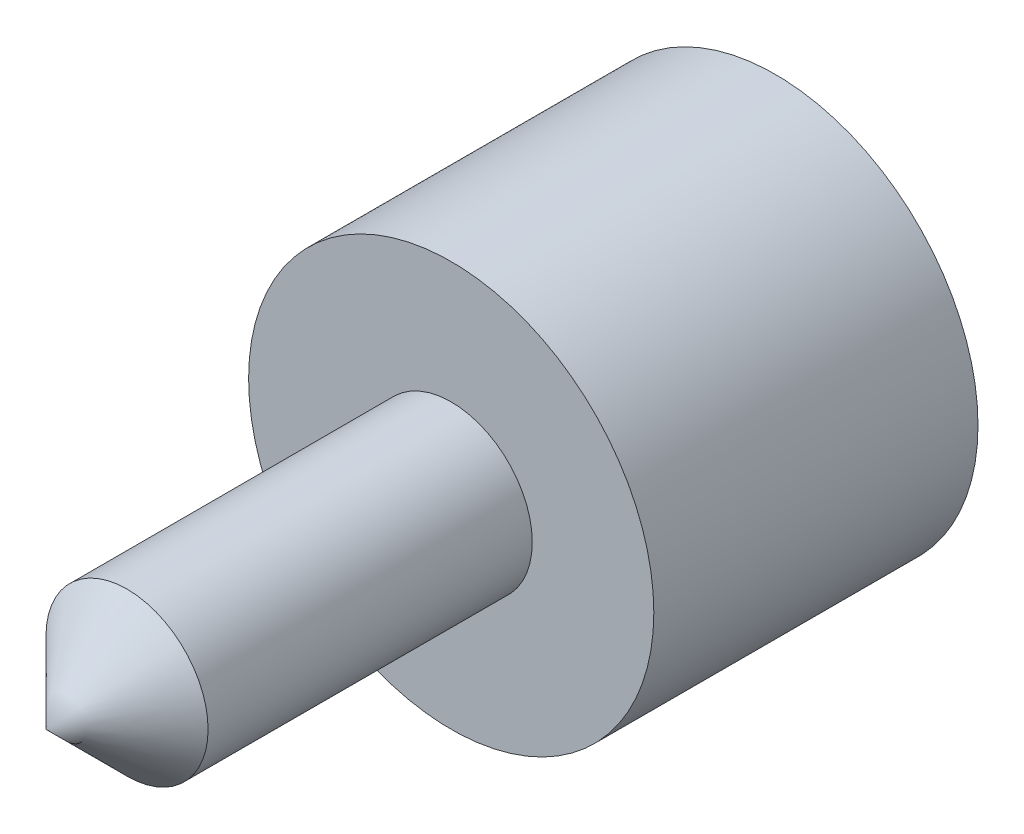
from build123d import *

# Parameters (mm, degrees)
CROQUIS1_R              = 5
SALIENTE_EXTRUIR1_DEPTH = 8
CROQUIS2_R              = 1.25
CORTAR_EXTRUIR1_DEPTH   = 6
CROQUIS3_R              = 2
SALIENTE_EXTRUIR2_DEPTH = 10
CHAFL_N1_SIZE           = 2


with BuildPart() as part:
    # Croquis1 → Saliente-Extruir1 (new body)
    with BuildSketch(Plane.XY):
        Circle(CROQUIS1_R)
    extrude(amount=SALIENTE_EXTRUIR1_DEPTH)

    # Croquis2 → Cortar-Extruir1 (cut)
    with BuildSketch(Plane(origin=(0, 0, 0), x_dir=(-1, 0, 0), z_dir=(0, 0, -1))):
        Circle(CROQUIS2_R)
    extrude(amount=-CORTAR_EXTRUIR1_DEPTH, mode=Mode.SUBTRACT)

    # Croquis3 → Saliente-Extruir2 (add)
    with BuildSketch(Plane.XY.offset(8)):
        Circle(CROQUIS3_R)
    extrude(amount=SALIENTE_EXTRUIR2_DEPTH)

    # Chaflán1
    chafl_n1_edges = [part.edges().sort_by_distance(p)[0] for p in [
        (-2, 0, 18),
    ]]
    chamfer(chafl_n1_edges, length=CHAFL_N1_SIZE)


solid = part.part
